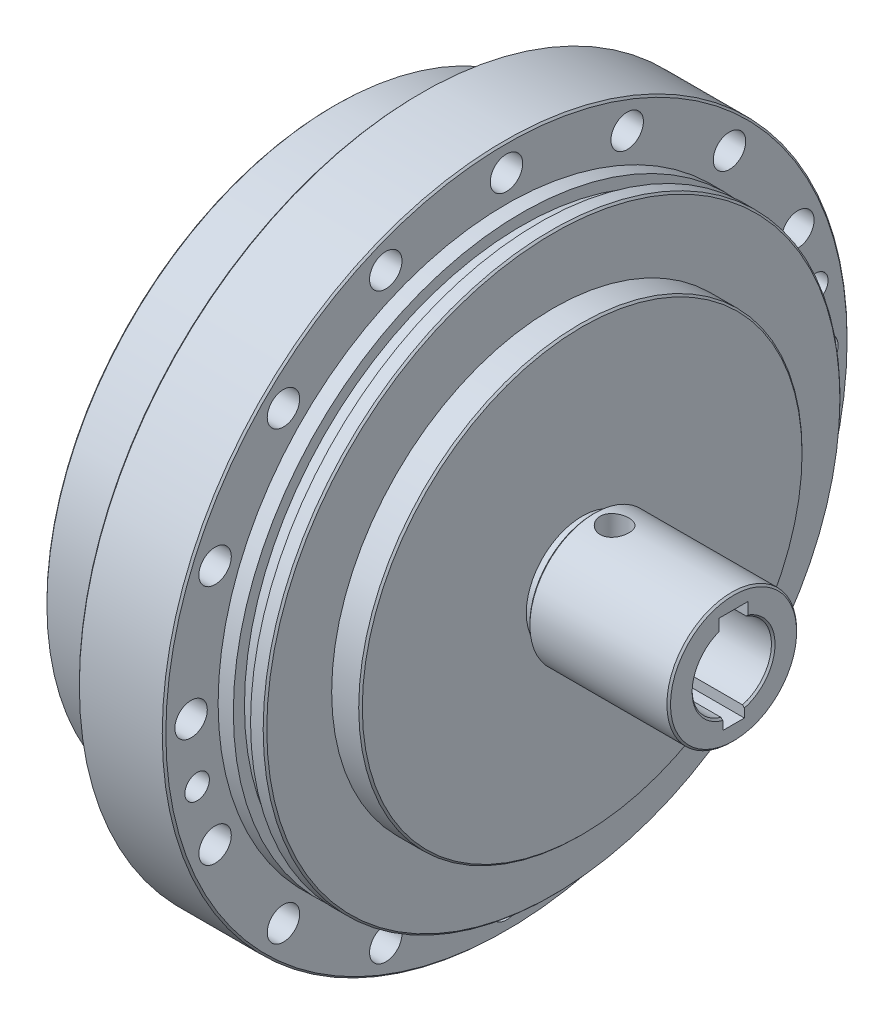
from build123d import *

# Parameters (mm, degrees)
CHAMFER_1_SIZE           = 0.5
CUT_EXTRUDE_1_REACH      = 150.388
SKETCH_2_R               = 4.5
PATTERN_CIRCULAR_1_COUNT = 16
HOLE_WIZARD_M8_1_D       = 6.8
HOLE_WIZARD_M14_1_D      = 12
HOLE_WIZARD_M14_1_DEPTH  = 24
HOLE_WIZARD_M14_1_TIP    = 3.605163714
CUT_EXTRUDE_2_DEPTH      = 33
SKETCH_12_R              = 4
CUT_EXTRUDE_3_DEPTH      = 179.812751223
SKETCH_14_R              = 25
CUT_EXTRUDE_4_DEPTH      = 3
CHAMFER_2_SIZE           = 0.5
SKETCH_19_W              = 6
SKETCH_19_H              = 2.916994756
CUT_EXTRUDE_5_DEPTH      = 33
SKETCH_20_W              = 2.5
SKETCH_20_H              = 81.5


with BuildPart() as part:
    # 草图1 → 旋转1 (revolve)
    with BuildSketch(Plane.XY, mode=Mode.PRIVATE) as revolve_1_sk:
        Polygon((3.8, 15.5), (3.8, 25), (0, 25), (0, 67.5), (7, 67.5), (7, 80), (31, 80), (31, 95), (55, 95), (55, 80), (59.22, 80), (59.22, 76.915), (64, 76.915), (64, 80), (68, 80), (68, 61.5), (76, 61.5), (76, 15.5), align=None)
        Polygon((56, 14.75), (56, 13.25), (33.25, 13.25), (32, 12), (3, 12), (3, 0), (118, 0), (118, 18), (79, 18), (79, 14.75), align=None)
    revolve(revolve_1_sk.sketch.rotate(Axis((0, 0, 0), (1, 0, 0)), 90), axis=Axis((0, 0, 0), (1, 0, 0)))

    # 倒角1
    chamfer_1_edges = [part.edges().sort_by_distance(p)[0] for p in [
        (3.8, 0, -15.5),
        (76, 0, -61.5),
        (68, 0, -80),
        (55, 0, -95),
        (31, 0, -95),
        (7, 0, -80),
        (0, 0, -67.5),
    ]]
    chamfer(chamfer_1_edges, length=CHAMFER_1_SIZE)

    # 草图2 → 切除-拉伸1 (cut, up to next)
    with BuildSketch(Plane(origin=(55, 0, 0), x_dir=(0, 0, -1), z_dir=(1, 0, 0)), mode=Mode.PRIVATE) as cut_extrude_1_sk1:
        with Locations((0, 87.5)):
            Circle(SKETCH_2_R)
    cut_extrude_1_tool1 = extrude(cut_extrude_1_sk1.sketch, amount=-CUT_EXTRUDE_1_REACH, mode=Mode.PRIVATE) & part.part
    cut_extrude_1 = cut_extrude_1_tool1.solids().sort_by_distance((55, 87.5, 0))[0]
    add(cut_extrude_1, mode=Mode.SUBTRACT)

    # 阵列(圆周)1: 切除-拉伸1 ×16 about axis
    pattern_circular_1_axis = Axis((0, 0, 0), (1, 0, 0))
    for i in range(1, PATTERN_CIRCULAR_1_COUNT):
        add(cut_extrude_1.rotate(pattern_circular_1_axis, i * 360 / PATTERN_CIRCULAR_1_COUNT), mode=Mode.SUBTRACT)

    # M8 螺纹孔1 (through all)
    with Locations(Plane(origin=(31, 17.070403176, -85.818712035), x_dir=(0, 0, -1), z_dir=(-1, 0, 0))):
        with Locations((0, 0), (-171.63742407, 34.140806352)):
            Hole(HOLE_WIZARD_M8_1_D / 2)

    # M14 螺纹孔1
    with Locations(Plane(origin=(0, -40.13845017, -28.105245381), x_dir=(0, 0, -1), z_dir=(-1, 0, 0))):
        with Locations((0, 0), (-56.210490762, 0), (-56.210490762, -80.27690034), (0, -80.27690034), (-28.105245381, 2.36154983), (-28.105245381, -82.63845017)):
            Hole(HOLE_WIZARD_M14_1_D / 2, depth=HOLE_WIZARD_M14_1_DEPTH)
            with Locations((0, 0, -(HOLE_WIZARD_M14_1_DEPTH + HOLE_WIZARD_M14_1_TIP / 2))):  # 118° drill point
                Cone(0, HOLE_WIZARD_M14_1_D / 2, HOLE_WIZARD_M14_1_TIP, mode=Mode.SUBTRACT)

    # 草图11 → 切除-拉伸2 (cut)
    with BuildSketch(Plane(origin=(118, 0, 0), x_dir=(0, 0, -1), z_dir=(1, 0, 0))):
        with BuildLine():
            Line((-3.9, 14), (3.9, 14))
            ThreePointArc((3.9, 14), (3.970710678, 13.970710678), (4, 13.9))
            Line((4, 13.9), (4, 10.246950766))
            ThreePointArc((4, 10.246950766), (0, -11), (-4, 10.246950766))
            Line((-4, 10.246950766), (-4, 13.9))
            ThreePointArc((-4, 13.9), (-3.970710678, 13.970710678), (-3.9, 14))
        make_face()
    extrude(amount=-CUT_EXTRUDE_2_DEPTH, mode=Mode.SUBTRACT)

    # 草图12 → 切除-拉伸3 (cut, through all)
    with BuildSketch(Plane(origin=(0, 0, 0), x_dir=(1, 0, 0), z_dir=(0, 1, 0))):
        with Locations(Location((85, 0, 0), (0, 0, 90))):
            Circle(SKETCH_12_R)
    extrude(amount=CUT_EXTRUDE_3_DEPTH, mode=Mode.SUBTRACT)

    # 草图14 → 切除-拉伸4 (cut)
    with BuildSketch(Plane.ZY):
        with Locations((-40, 0)):
            Circle(SKETCH_14_R)
        with Locations((40, 0)):
            Circle(SKETCH_14_R)
    extrude(amount=-CUT_EXTRUDE_4_DEPTH, mode=Mode.SUBTRACT)

    # 草图18 → 切除-旋转1 (revolve, cut)
    with BuildSketch(Plane.XY, mode=Mode.PRIVATE) as cut_revolve_1_sk:
        Polygon((85, 6), (73, 6), (69.535898385, 0), (85, 0), align=None)
    revolve(cut_revolve_1_sk.sketch.rotate(Axis((0, 0, 0), (1, 0, 0)), 270), axis=Axis((0, 0, 0), (1, 0, 0)), mode=Mode.SUBTRACT)

    # 倒角2
    chamfer_2_edges = [part.edges().sort_by_distance(p)[0] for p in [
        (118, -11, 0),
        (79, 0, -18),
        (118, 0, -18),
    ]]
    chamfer(chamfer_2_edges, length=CHAMFER_2_SIZE)

    # 草图19 → 切除-拉伸5 (cut)
    with BuildSketch(Plane(origin=(118, 0, 0), x_dir=(0, 0, -1), z_dir=(1, 0, 0))):
        with Locations((0, -12.041502622)):
            Rectangle(SKETCH_19_W, SKETCH_19_H)
    extrude(amount=-CUT_EXTRUDE_5_DEPTH, mode=Mode.SUBTRACT)

    # 草图20 → M6 螺纹孔1 (revolve, cut)
    with BuildSketch(Plane(origin=(92, -13.5, 0), x_dir=(0, 0, 1), z_dir=(1, 0, 0))):
        with Locations((1.25, 40.75)):
            Rectangle(SKETCH_20_W, SKETCH_20_H)
    revolve(axis=Axis((92, -7.15, 0), (0, -1, 0)), mode=Mode.SUBTRACT)


solid = part.part
